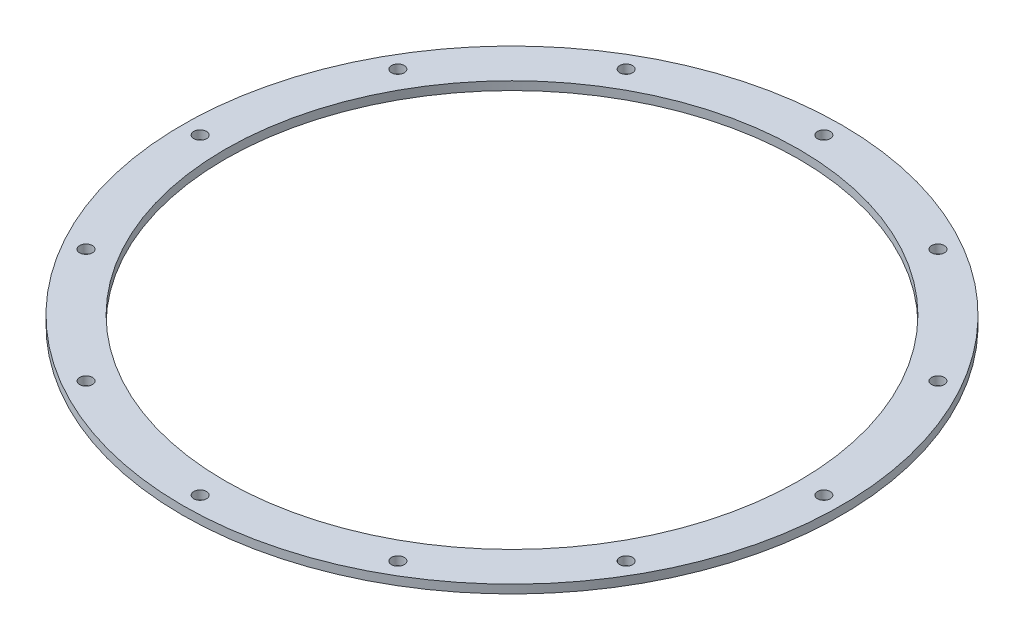
from build123d import *

# Parameters (mm, degrees)
SKETCH1_R           = 232.5
SKETCH1_R_2         = 202.5
BOSS_EXTRUDE1_DEPTH = 6
SKETCH2_R           = 4.5
CUT_EXTRUDE1_DEPTH  = 10
CIRPATTERN1_COUNT   = 12


with BuildPart() as part:
    # Sketch1 → Boss-Extrude1 (new body)
    with BuildSketch(Plane(origin=(0, 0, 0), x_dir=(1, 0, 0), z_dir=(0, 1, 0))):
        with Locations(Location((0, 0, 0), (0, 0, 270))):
            Circle(SKETCH1_R)
        with Locations(Location((0, 0, 0), (0, 0, 270))):
            Circle(SKETCH1_R_2, mode=Mode.SUBTRACT)
    extrude(amount=BOSS_EXTRUDE1_DEPTH)

    # Sketch2 → Cut-Extrude1 (cut)
    with BuildSketch(Plane(origin=(0, 6, 0), x_dir=(1, 0, 0), z_dir=(0, 1, 0))):
        with Locations(Location((0, 220, 0), (0, 0, 270))):
            Circle(SKETCH2_R)
    cut_extrude1 = extrude(amount=-CUT_EXTRUDE1_DEPTH, mode=Mode.SUBTRACT)

    # CirPattern1: Cut-Extrude1 ×12 about axis
    cirpattern1_axis = Axis((0, 0, 0), (0, 1, 0))
    for i in range(1, CIRPATTERN1_COUNT):
        add(cut_extrude1.rotate(cirpattern1_axis, i * 360 / CIRPATTERN1_COUNT), mode=Mode.SUBTRACT)


solid = part.part
